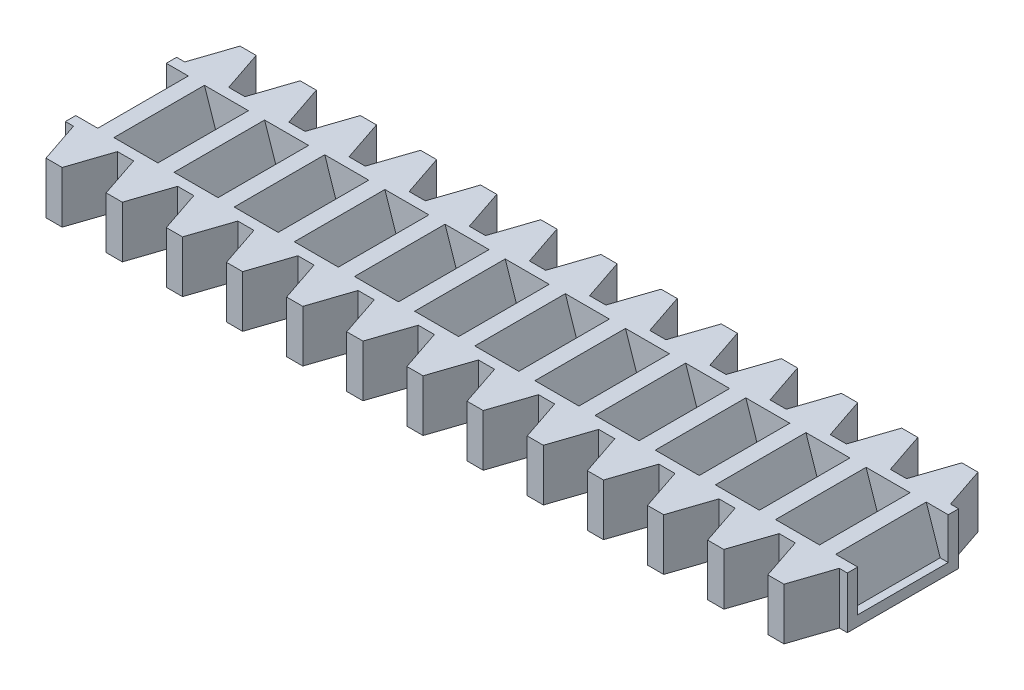
from build123d import *

# Parameters (mm, degrees)
SKETCH_1_W                     = 4.65
SKETCH_1_H                     = 8.6
EXTRUDE_1_DEPTH                = 4
EXTRUDE_2_DEPTH                = 4
CUT_EXTRUDE_1_DEPTH            = 3.5
PATTERN_LINEAR_4_COUNT         = 13
PATTERN_LINEAR_4_PITCH         = 4.65
PATTERN_LINEAR_4_COPY_1_DEPTH  = 4
PATTERN_LINEAR_4_COPY_2_DEPTH  = 4
PATTERN_LINEAR_4_COPY_3_DEPTH  = 4
PATTERN_LINEAR_4_COPY_4_DEPTH  = 4
PATTERN_LINEAR_4_COPY_5_DEPTH  = 4
PATTERN_LINEAR_4_COPY_6_DEPTH  = 4
PATTERN_LINEAR_4_COPY_7_DEPTH  = 4
PATTERN_LINEAR_4_COPY_8_DEPTH  = 4
PATTERN_LINEAR_4_COPY_9_DEPTH  = 4
PATTERN_LINEAR_4_COPY_10_DEPTH = 4
PATTERN_LINEAR_4_COPY_11_DEPTH = 4
PATTERN_LINEAR_4_COPY_12_DEPTH = 4
EXTRUDE_START                  = 1
EXTRUDE_4_DEPTH                = 53.8
FILLET_1_R                     = 0.1


with BuildPart() as part:
    # 草图1 → 凸台-拉伸1 (new body)
    with BuildSketch(Plane(origin=(0, 0, 0), x_dir=(1, 0, 0), z_dir=(0, 1, 0))):
        Rectangle(SKETCH_1_W, SKETCH_1_H)
    extrude_1 = extrude(amount=EXTRUDE_1_DEPTH)

    # 草图3 → 凸台-拉伸2 (add)
    with BuildSketch(Plane(origin=(0, 0, 0), x_dir=(1, 0, 0), z_dir=(0, 1, 0))):
        Polygon((0.625, 7.5), (-0.625, 7.5), (-1.7, 4.3), (1.7, 4.3), align=None)
    extrude_2 = extrude(amount=EXTRUDE_2_DEPTH)

    # 镜向1: 凸台-拉伸2 across plane
    add(extrude_2.mirror(Plane.XY))

    # 草图4 → 切除-拉伸1 (cut, symmetric)
    with BuildSketch(Plane.XY):
        Polygon((-0.625, 4), (-2.325, 4), (-2.325, 0.8), (-1.7, 0.8), align=None)
        Polygon((1.7, 0.8), (2.325, 0.8), (2.325, 4), (0.625, 4), align=None)
    cut_extrude_1 = extrude(amount=CUT_EXTRUDE_1_DEPTH, both=True, mode=Mode.SUBTRACT)

    # 阵列(线性)4: 凸台-拉伸1, 凸台-拉伸2, 切除-拉伸1 ×13
    with Locations(*[(i * PATTERN_LINEAR_4_PITCH, 0, 0) for i in range(1, PATTERN_LINEAR_4_COUNT)]):
        add(extrude_1)
        add(extrude_2)
        add(cut_extrude_1, mode=Mode.SUBTRACT)

    # 阵列(线性)4 copy 1 sketch → 阵列(线性)4 copy 1 (add)
    with BuildSketch(Plane(origin=(4.65, 0, 0), x_dir=(1, 0, 0), z_dir=(0, 1, 0))):
        Polygon((0.625, -7.5), (-0.625, -7.5), (-1.7, -4.3), (1.7, -4.3), align=None)
    extrude(amount=PATTERN_LINEAR_4_COPY_1_DEPTH)

    # 阵列(线性)4 copy 2 sketch → 阵列(线性)4 copy 2 (add)
    with BuildSketch(Plane(origin=(9.3, 0, 0), x_dir=(1, 0, 0), z_dir=(0, 1, 0))):
        Polygon((0.625, -7.5), (-0.625, -7.5), (-1.7, -4.3), (1.7, -4.3), align=None)
    extrude(amount=PATTERN_LINEAR_4_COPY_2_DEPTH)

    # 阵列(线性)4 copy 3 sketch → 阵列(线性)4 copy 3 (add)
    with BuildSketch(Plane(origin=(13.95, 0, 0), x_dir=(1, 0, 0), z_dir=(0, 1, 0))):
        Polygon((0.625, -7.5), (-0.625, -7.5), (-1.7, -4.3), (1.7, -4.3), align=None)
    extrude(amount=PATTERN_LINEAR_4_COPY_3_DEPTH)

    # 阵列(线性)4 copy 4 sketch → 阵列(线性)4 copy 4 (add)
    with BuildSketch(Plane(origin=(18.6, 0, 0), x_dir=(1, 0, 0), z_dir=(0, 1, 0))):
        Polygon((0.625, -7.5), (-0.625, -7.5), (-1.7, -4.3), (1.7, -4.3), align=None)
    extrude(amount=PATTERN_LINEAR_4_COPY_4_DEPTH)

    # 阵列(线性)4 copy 5 sketch → 阵列(线性)4 copy 5 (add)
    with BuildSketch(Plane(origin=(23.25, 0, 0), x_dir=(1, 0, 0), z_dir=(0, 1, 0))):
        Polygon((0.625, -7.5), (-0.625, -7.5), (-1.7, -4.3), (1.7, -4.3), align=None)
    extrude(amount=PATTERN_LINEAR_4_COPY_5_DEPTH)

    # 阵列(线性)4 copy 6 sketch → 阵列(线性)4 copy 6 (add)
    with BuildSketch(Plane(origin=(27.9, 0, 0), x_dir=(1, 0, 0), z_dir=(0, 1, 0))):
        Polygon((0.625, -7.5), (-0.625, -7.5), (-1.7, -4.3), (1.7, -4.3), align=None)
    extrude(amount=PATTERN_LINEAR_4_COPY_6_DEPTH)

    # 阵列(线性)4 copy 7 sketch → 阵列(线性)4 copy 7 (add)
    with BuildSketch(Plane(origin=(32.55, 0, 0), x_dir=(1, 0, 0), z_dir=(0, 1, 0))):
        Polygon((0.625, -7.5), (-0.625, -7.5), (-1.7, -4.3), (1.7, -4.3), align=None)
    extrude(amount=PATTERN_LINEAR_4_COPY_7_DEPTH)

    # 阵列(线性)4 copy 8 sketch → 阵列(线性)4 copy 8 (add)
    with BuildSketch(Plane(origin=(37.2, 0, 0), x_dir=(1, 0, 0), z_dir=(0, 1, 0))):
        Polygon((0.625, -7.5), (-0.625, -7.5), (-1.7, -4.3), (1.7, -4.3), align=None)
    extrude(amount=PATTERN_LINEAR_4_COPY_8_DEPTH)

    # 阵列(线性)4 copy 9 sketch → 阵列(线性)4 copy 9 (add)
    with BuildSketch(Plane(origin=(41.85, 0, 0), x_dir=(1, 0, 0), z_dir=(0, 1, 0))):
        Polygon((0.625, -7.5), (-0.625, -7.5), (-1.7, -4.3), (1.7, -4.3), align=None)
    extrude(amount=PATTERN_LINEAR_4_COPY_9_DEPTH)

    # 阵列(线性)4 copy 10 sketch → 阵列(线性)4 copy 10 (add)
    with BuildSketch(Plane(origin=(46.5, 0, 0), x_dir=(1, 0, 0), z_dir=(0, 1, 0))):
        Polygon((0.625, -7.5), (-0.625, -7.5), (-1.7, -4.3), (1.7, -4.3), align=None)
    extrude(amount=PATTERN_LINEAR_4_COPY_10_DEPTH)

    # 阵列(线性)4 copy 11 sketch → 阵列(线性)4 copy 11 (add)
    with BuildSketch(Plane(origin=(51.15, 0, 0), x_dir=(1, 0, 0), z_dir=(0, 1, 0))):
        Polygon((0.625, -7.5), (-0.625, -7.5), (-1.7, -4.3), (1.7, -4.3), align=None)
    extrude(amount=PATTERN_LINEAR_4_COPY_11_DEPTH)

    # 阵列(线性)4 copy 12 sketch → 阵列(线性)4 copy 12 (add)
    with BuildSketch(Plane(origin=(55.8, 0, 0), x_dir=(1, 0, 0), z_dir=(0, 1, 0))):
        Polygon((0.625, -7.5), (-0.625, -7.5), (-1.7, -4.3), (1.7, -4.3), align=None)
    extrude(amount=PATTERN_LINEAR_4_COPY_12_DEPTH)

    # 草图6 → 凸台-拉伸4 (add)
    with BuildSketch(Plane(origin=(0, 0, 0), x_dir=(0, 0, -1), z_dir=(1, 0, 0)).offset(EXTRUDE_START)):
        with BuildLine():
            Line((1.5, 0), (0.5, 0))
            Line((0.5, 0), (0.5, -1.07225346))
            Line((0.5, -1.07225346), (1.165769145, -2.5))
            Line((1.165769145, -2.5), (1.95, -2.5))
            Line((1.95, -2.5), (1.95, -1.555590279))
            ThreePointArc((1.95, -1.555590279), (1.780042303, -1.088161527), (1.5, -0.677124344))
            Line((1.5, -0.677124344), (1.5, 0))
        make_face()
        with BuildLine():
            Line((-0.5, -1.07225346), (-1.165769145, -2.5))
            Line((-1.165769145, -2.5), (-1.95, -2.5))
            Line((-1.95, -2.5), (-1.95, -1.555590279))
            ThreePointArc((-1.95, -1.555590279), (-1.780042303, -1.088161527), (-1.5, -0.677124344))
            Line((-1.5, -0.677124344), (-1.5, 0))
            Line((-1.5, 0), (-0.5, 0))
            Line((-0.5, 0), (-0.5, -1.07225346))
        make_face()
    extrude(amount=EXTRUDE_4_DEPTH)

    # 圆角1
    fillet_1_edges = [part.edges().sort_by_distance(p)[0] for p in [
        (1, -2.5, -1.557884573),
        (27.9, -2.5, -1.165769145),
        (27.9, -2.5, -1.95),
        (54.8, -2.5, -1.557884573),
        (1, -2.5, 1.557884573),
        (27.9, -2.5, 1.95),
        (27.9, -2.5, 1.165769145),
        (54.8, -2.5, 1.557884573),
    ]]
    fillet(fillet_1_edges, radius=FILLET_1_R)


solid = part.part
